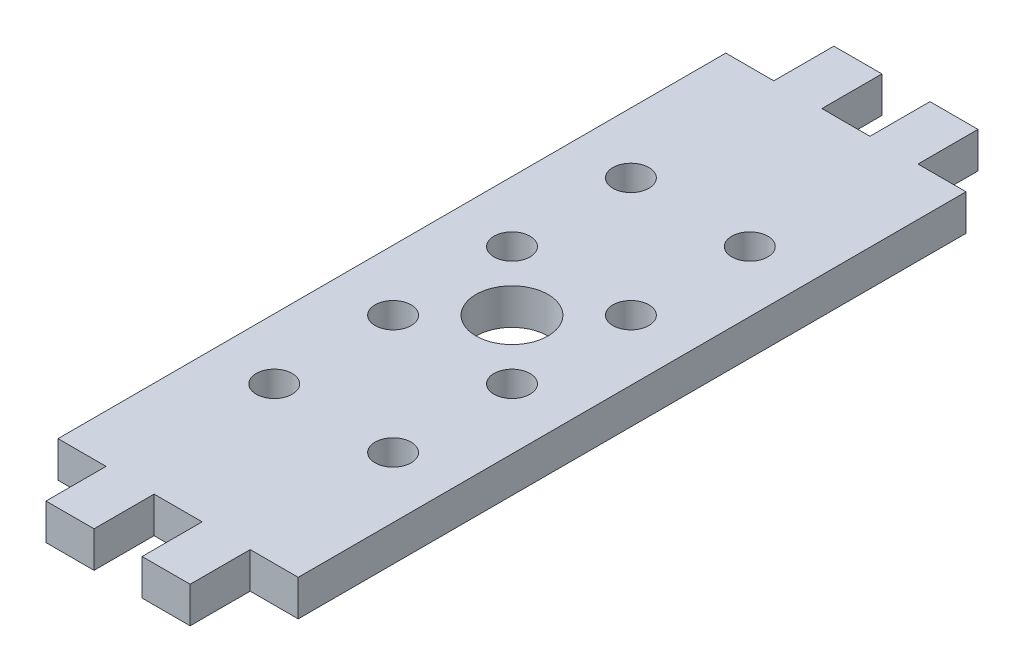
from build123d import *

# Parameters (mm, degrees)
SKETCH_1_W          = 20
SKETCH_1_H          = 55.6
EXTRUDE_1_DEPTH     = 3
SKETCH_2_W          = 4
SKETCH_2_H          = 5
EXTRUDE_2_DEPTH     = 3
SKETCH_3_R          = 1.5
SKETCH_3_R_2        = 3
CUT_EXTRUDE_1_DEPTH = 10


with BuildPart() as part:
    # 草图1 → 凸台-拉伸1 (new body)
    with BuildSketch(Plane(origin=(0, 0, 0), x_dir=(1, 0, 0), z_dir=(0, 1, 0))):
        with Locations((-10, -27.8)):
            Rectangle(SKETCH_1_W, SKETCH_1_H)
    extrude(amount=EXTRUDE_1_DEPTH)

    # 草图2 → 凸台-拉伸2 (add)
    with BuildSketch(Plane(origin=(0, 3, 0), x_dir=(1, 0, 0), z_dir=(0, 1, 0))):
        with Locations((-14, 2.5)):
            Rectangle(SKETCH_2_W, SKETCH_2_H)
        with Locations((-6, 2.5)):
            Rectangle(SKETCH_2_W, SKETCH_2_H)
        with Locations((-14, -58.1)):
            Rectangle(SKETCH_2_W, SKETCH_2_H)
        with Locations((-6, -58.1)):
            Rectangle(SKETCH_2_W, SKETCH_2_H)
    extrude(amount=-EXTRUDE_2_DEPTH)

    # 草图3 → 切除-拉伸1 (cut)
    with BuildSketch(Plane(origin=(0, 3, 0), x_dir=(1, 0, 0), z_dir=(0, 1, 0))):
        with Locations(Location((-5.050252532, -22.850252532, 0), (0, 0, 270))):
            Circle(SKETCH_3_R)
        with Locations(Location((-10, -27.8, 0), (0, 0, 270))):
            Circle(SKETCH_3_R_2)
        with Locations(Location((-14.949747468, -32.749747468, 0), (0, 0, 270))):
            Circle(SKETCH_3_R)
        with Locations(Location((-5.050252532, -32.749747468, 0), (0, 0, 270))):
            Circle(SKETCH_3_R)
        with Locations(Location((-14.949747468, -22.850252532, 0), (0, 0, 270))):
            Circle(SKETCH_3_R)
        with Locations(Location((-14.949747468, -12.950757595, 0), (0, 0, 270))):
            Circle(SKETCH_3_R)
        with Locations(Location((-5.050252532, -12.950757595, 0), (0, 0, 270))):
            Circle(SKETCH_3_R)
        with Locations(Location((-14.949747468, -42.649242405, 0), (0, 0, 270))):
            Circle(SKETCH_3_R)
        with Locations(Location((-5.050252532, -42.649242405, 0), (0, 0, 270))):
            Circle(SKETCH_3_R)
    extrude(amount=-CUT_EXTRUDE_1_DEPTH, mode=Mode.SUBTRACT)


solid = part.part
